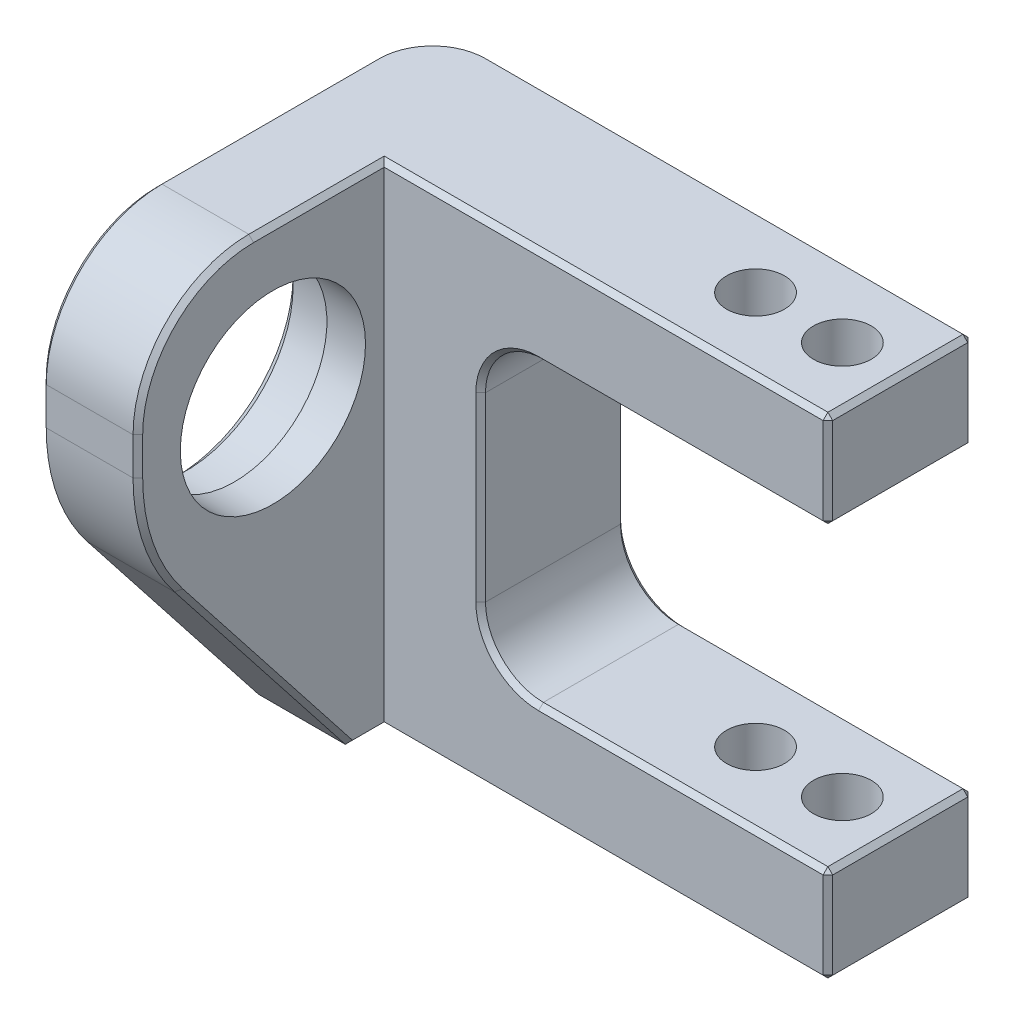
from build123d import *

# Parameters (mm, degrees)
BOSS_EXTRUDE1_DEPTH = 50.8
SKETCH2_R           = 11.1
CUT_EXTRUDE1_DEPTH  = 6
SKETCH4_R           = 9.6
CUT_EXTRUDE2_DEPTH  = 79.563869558
SKETCH5_R           = 3
CUT_EXTRUDE3_DEPTH  = 83.512311809
CUT_EXTRUDE4_DEPTH  = 83.512311809
FILLET3_R           = 20
FILLET4_R           = 12
SKETCH8_W           = 36
SKETCH8_H           = 30.8
CUT_EXTRUDE5_DEPTH  = 80.805586271
CHAMFER2_SIZE       = 1
FILLET6_R           = 6
FILLET5_R           = 6
CHAMFER3_SIZE       = 0.5


with BuildPart() as part:
    # Sketch1 → Boss-Extrude1 (new body)
    with BuildSketch(Plane(origin=(0, 0, 0), x_dir=(1, 0, 0), z_dir=(0, 1, 0))):
        Polygon((-56, 7.5), (-56, -33.04), (-46, -33.04), (-46, -7.5), (0, -7.5), (0, 7.5), align=None)
    extrude(amount=BOSS_EXTRUDE1_DEPTH)

    # Sketch2 → Cut-Extrude1 (cut)
    with BuildSketch(Plane.ZY.offset(56)):
        with Locations((19.04, 35.4)):
            Circle(SKETCH2_R)
    extrude(amount=-CUT_EXTRUDE1_DEPTH, mode=Mode.SUBTRACT)

    # Sketch4 → Cut-Extrude2 (cut, through all)
    with BuildSketch(Plane.ZY.offset(50)):
        with Locations((19.04, 35.4)):
            Circle(SKETCH4_R)
    extrude(amount=-CUT_EXTRUDE2_DEPTH, mode=Mode.SUBTRACT)

    # Sketch5 → Cut-Extrude3 (cut, through all)
    with BuildSketch(Plane(origin=(0, 50.8, 0), x_dir=(1, 0, 0), z_dir=(0, 1, 0))):
        with Locations(Location((-6, 0, 0), (0, 0, 270))):
            Circle(SKETCH5_R)
        with Locations(Location((-15, 0, 0), (0, 0, 270))):
            Circle(SKETCH5_R)
    extrude(amount=-CUT_EXTRUDE3_DEPTH, mode=Mode.SUBTRACT)

    # Sketch6 → Cut-Extrude4 (cut, through all)
    with BuildSketch(Plane.ZY.offset(56)):
        Polygon((11.04, 0), (33.04, 0), (33.04, 28), align=None)
    extrude(amount=-CUT_EXTRUDE4_DEPTH, mode=Mode.SUBTRACT)

    # Fillet3
    fillet3_edges = [part.edges().sort_by_distance(p)[0] for p in [
        (-51, 28, 33.04),
    ]]
    fillet(fillet3_edges, radius=FILLET3_R)

    # Fillet4
    fillet4_edges = [part.edges().sort_by_distance(p)[0] for p in [
        (-51, 50.8, 33.04),
    ]]
    fillet(fillet4_edges, radius=FILLET4_R)

    # Sketch8 → Cut-Extrude5 (cut, through all)
    with BuildSketch(Plane.XY.offset(7.5)):
        with Locations((-18, 25.4)):
            Rectangle(SKETCH8_W, SKETCH8_H)
    extrude(amount=-CUT_EXTRUDE5_DEPTH, mode=Mode.SUBTRACT)

    # Chamfer2
    chamfer2_edges = [part.edges().sort_by_distance(p)[0] for p in [
        (-56, 35.4, 7.94),
    ]]
    chamfer(chamfer2_edges, length=CHAMFER2_SIZE)

    # Fillet6
    fillet6_edges = [part.edges().sort_by_distance(p)[0] for p in [
        (-56, 25.4, -7.5),
    ]]
    fillet(fillet6_edges, radius=FILLET6_R)

    # Fillet5
    fillet5_edges = [part.edges().sort_by_distance(p)[0] for p in [
        (-36, 40.8, 0),
        (-36, 10, 0),
    ]]
    fillet(fillet5_edges, radius=FILLET5_R)

    # Chamfer3
    chamfer3_edges = [part.edges().sort_by_distance(p)[0] for p in [
        (-54.242640687, 50.8, -5.742640687),
        (-15, 10, 7.5),
        (-15, 10, -7.5),
        (-36, 25.4, 7.5),
        (-36, 25.4, -7.5),
        (-34.242640687, 11.757359313, 7.5),
        (-34.242640687, 11.757359313, -7.5),
        (-34.242640687, 39.042640687, 7.5),
        (0, 45.8, 7.5),
        (-34.242640687, 39.042640687, -7.5),
        (0, 45.8, -7.5),
        (-46, 50.8, 14.27),
        (-23, 50.8, 7.5),
        (-46, 11.280415221, 19.903183388),
        (0, 50.8, 0),
        (-56, 11.280415221, 19.903183388),
        (-56, 28.37995835, 31.941419729),
        (-46, 28.37995835, 31.941419729),
        (-46, 36.858630741, 33.04),
        (-46, 47.285281374, 29.525281374),
        (-56, 36.858630741, 33.04),
        (-56, 47.285281374, 29.525281374),
        (-23, 0, 7.5),
        (-46, 0, 9.27),
        (0, 5, 7.5),
        (0, 5, -7.5),
        (0, 10, 0),
        (-15, 40.8, -7.5),
        (0, 40.8, 0),
        (-15, 40.8, 7.5),
        (-25, 0, -7.5),
        (0, 0, 0),
        (-25, 50.8, -7.5),
        (-56, 50.8, 9.77),
        (-56, 0, 4.77),
        (-54.242640687, 0, -5.742640687),
    ]]
    chamfer(chamfer3_edges, length=CHAMFER3_SIZE)


solid = part.part
